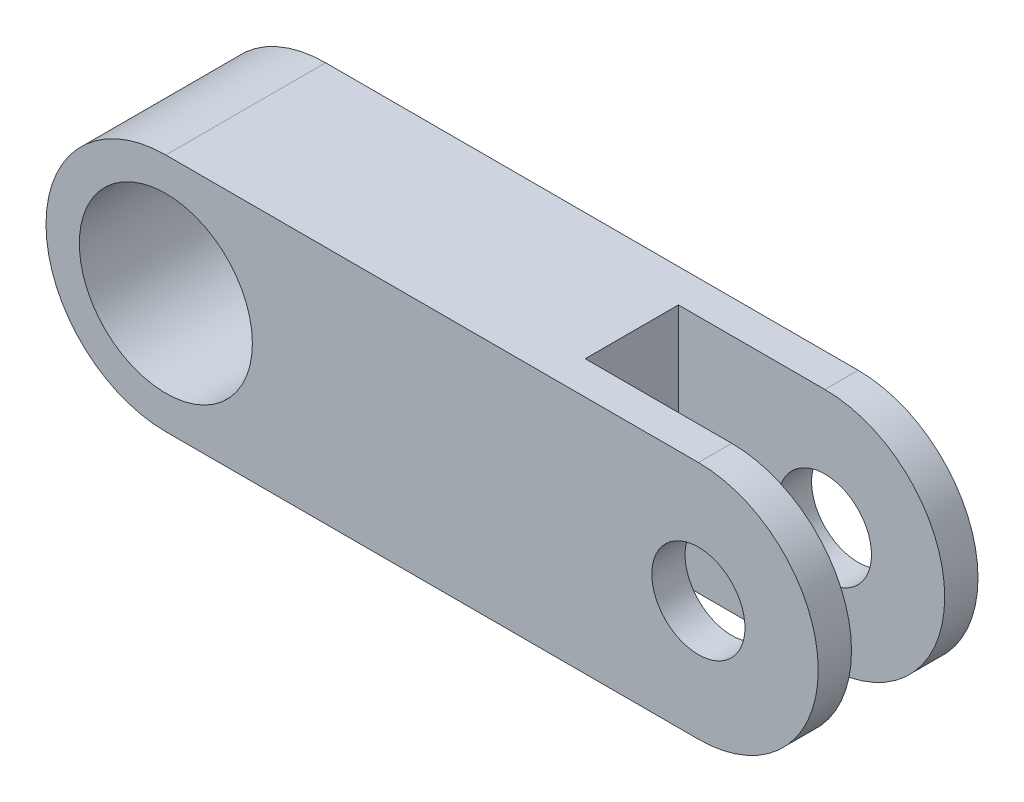
from build123d import *

# Parameters (mm, degrees)
SKETCH1_R           = 3.25
SKETCH1_R_2         = 1.75
BOSS_EXTRUDE1_DEPTH = 3
SKETCH5_W           = 10
SKETCH5_H           = 9
CUT_EXTRUDE1_DEPTH  = 1.75


with BuildPart() as part:
    # Sketch1 → Boss-Extrude1 (new, symmetric)
    with BuildSketch(Plane.XY):
        with BuildLine():
            Line((-10, 4.5), (10, 4.5))
            ThreePointArc((10, 4.5), (14.5, 0), (10, -4.5))
            Line((10, -4.5), (-10, -4.5))
            ThreePointArc((-10, -4.5), (-14.5, 0), (-10, 4.5))
        make_face()
        with Locations((-10, 0)):
            Circle(SKETCH1_R, mode=Mode.SUBTRACT)
        with Locations((10, 0)):
            Circle(SKETCH1_R_2, mode=Mode.SUBTRACT)
    extrude(amount=BOSS_EXTRUDE1_DEPTH, both=True)

    # Sketch5 → Cut-Extrude1 (cut, symmetric)
    with BuildSketch(Plane.XY):
        with Locations((9.5, 0)):
            Rectangle(SKETCH5_W, SKETCH5_H)
    extrude(amount=CUT_EXTRUDE1_DEPTH, both=True, mode=Mode.SUBTRACT)


solid = part.part
